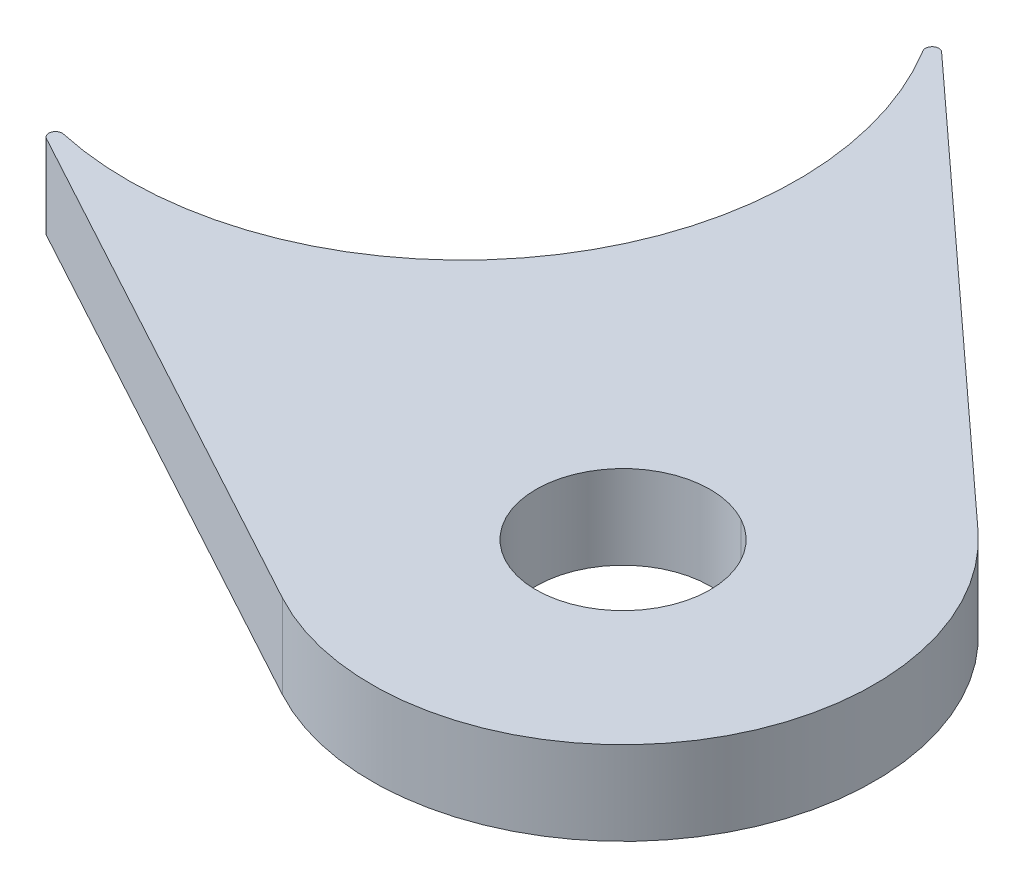
from build123d import *

# Parameters (mm, degrees)
SKETCH1_R           = 3.2999999999999763
BOSS_EXTRUDE1_DEPTH = 3.175
FILLET1_R           = 0.254


with BuildPart() as part:
    # Sketch1 → Boss-Extrude1 (new body)
    with BuildSketch(Plane(origin=(0, 0, 0), x_dir=(1, 0, 0), z_dir=(0, 1, 0))):
        with BuildLine():
            Line((16.658670688660017, -23.4844478514352), (-6.05546921231891, -11.163390731254449))
            ThreePointArc((-6.05546921231891, -11.163390731254449), (10.341596389219115, -7.37166087950944), (8.577809795055275, 9.36542466308141))
            Line((8.577809795055275, 9.36542466308141), (27.633629944190663, -8.087836305683298))
            ThreePointArc((27.633629944190663, -8.087836305683298), (28.956469889813544, -20.640650462626443), (16.658670688660017, -23.4844478514352))
        make_face()
        with Locations(Location((21.2002725978992, -15.11190480299436, 0), (0, 0, 270))):
            Circle(SKETCH1_R, mode=Mode.SUBTRACT)
    extrude(amount=BOSS_EXTRUDE1_DEPTH)

    # Fillet1
    fillet1_edges = [part.edges().sort_by_distance(p)[0] for p in [
        (-6.05546921231891, 1.5875, 11.163390731254449),
        (8.577809795055277, 1.5875, -9.36542466308141),
    ]]
    fillet(fillet1_edges, radius=FILLET1_R)


solid = part.part
